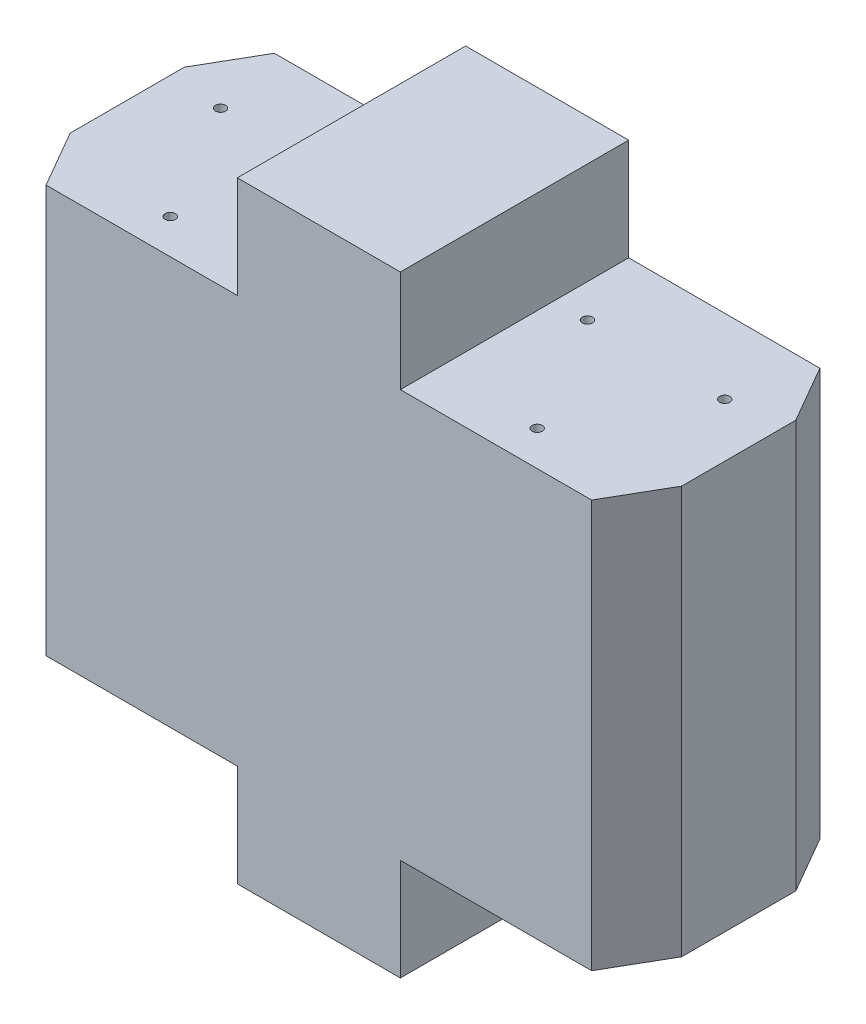
from build123d import *

# Parameters (mm, degrees)
ESQUISSE1_W             = 150
ESQUISSE1_H             = 14
BOSS_EXTRU_1_DEPTH      = 100
BOSS_EXTRU_2_DEPTH      = 25
BOSS_EXTRU_2_DEPTH_BACK = 125
ESQUISSE3_W             = 40
ESQUISSE3_H             = 56
COQUE1_T                = -4
ESQUISSE2_R             = 1.25
ENL_V_MAT_EXTRU_1_DEPTH = 150.916643506


with BuildPart() as part:
    # Esquisse1 → Boss.-Extru.1 (new body)
    with BuildSketch(Plane(origin=(0, 0, 0), x_dir=(1, 0, 0), z_dir=(0, 1, 0))):
        Rectangle(ESQUISSE1_W, ESQUISSE1_H)
        Polygon((66.917096231, 21), (75, 7), (-75, 7), (-66.917096231, 21), align=None)
    boss_extru_1 = extrude(amount=BOSS_EXTRU_1_DEPTH)

    # Symétrie1: Boss.-Extru.1 across plane
    add(boss_extru_1.mirror(Plane(origin=(0, 100, 7), x_dir=(1, 0, 0), z_dir=(0, 0, -1))))

    # Esquisse3 → Boss.-Extru.2 (add, two sides: drawn at the far end of the back side and taken through both)
    with BuildSketch(Plane.XZ.offset(-BOSS_EXTRU_2_DEPTH_BACK)):
        with Locations((0, 7)):
            Rectangle(ESQUISSE3_W, ESQUISSE3_H)
    extrude(amount=BOSS_EXTRU_2_DEPTH + BOSS_EXTRU_2_DEPTH_BACK)

    # Coque1
    coque1_openings = [part.faces().sort_by_distance(p)[0] for p in [
        (0, 50, -21),
    ]]
    offset(amount=COQUE1_T, openings=coque1_openings, kind=Kind.INTERSECTION)

    # Esquisse2 → Enlèv. mat.-Extru.1 (cut, through all)
    with BuildSketch(Plane(origin=(0, 100, 0), x_dir=(1, 0, 0), z_dir=(0, 1, 0))):
        with Locations(Location((45, -26.45, 0), (0, 0, 270))):
            Circle(ESQUISSE2_R)
        with Locations(Location((61.844194104, 2.725, 0), (0, 0, 270))):
            Circle(ESQUISSE2_R)
        with Locations(Location((28.155805896, 2.725, 0), (0, 0, 270))):
            Circle(ESQUISSE2_R)
    enl_v_mat_extru_1 = extrude(amount=-ENL_V_MAT_EXTRU_1_DEPTH, mode=Mode.SUBTRACT)

    # Symétrie2: Enlèv. mat.-Extru.1 across plane
    add(enl_v_mat_extru_1.mirror(Plane(origin=(0, 0, 0), x_dir=(0, 0, 1), z_dir=(1, 0, 0))), mode=Mode.SUBTRACT)


solid = part.part
